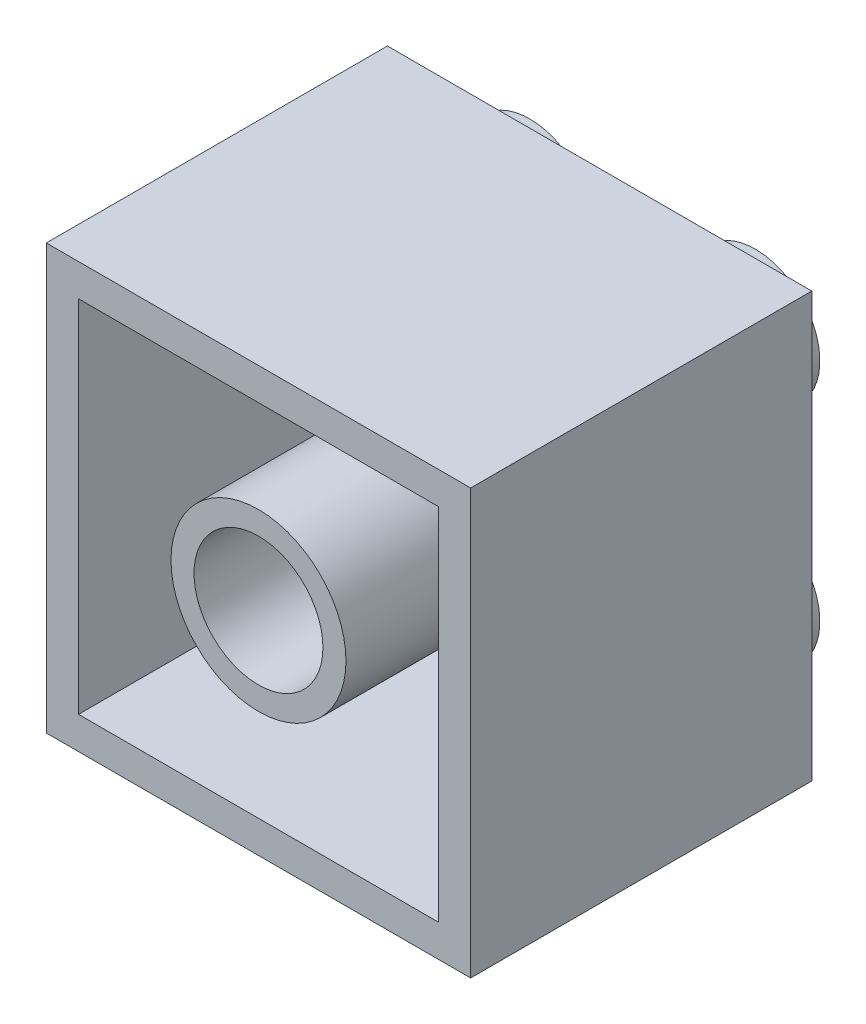
from build123d import *

# Parameters (mm, degrees)
SKETCH2_W           = 15.8
SKETCH2_H           = 15.8
BOSS_EXTRUDE1_DEPTH = 12.7
CUT_EXTRUDE1_DEPTH  = 11.49999986
SKETCH5_R           = 3.256854249
BOSS_EXTRUDE3_DEPTH = 11.5
SKETCH6_R           = 2.4
CUT_EXTRUDE2_DEPTH  = 11.5
SKETCH4_R           = 2.4
BOSS_EXTRUDE4_DEPTH = 1.6
SKETCH7_R           = 1.2
CUT_EXTRUDE3_DEPTH  = 1.6
CUT_EXTRUDE4_DEPTH  = 0.4


with BuildPart() as part:
    # Sketch2 → Boss-Extrude1 (new body)
    with BuildSketch(Plane(origin=(0, 0, 0), x_dir=(0, 1, 0), z_dir=(0, 0, 1))):
        Rectangle(SKETCH2_W, SKETCH2_H)
    extrude(amount=BOSS_EXTRUDE1_DEPTH)

    # 3DSketch1 → Cut-Extrude1 (cut)
    with BuildSketch(Plane(origin=(-6.7, -6.7, 12.7), x_dir=(0.7071067811865477, 0.7071067811865474, 0), z_dir=(0, 0, 1))):
        Polygon((0, 0), (9.475230868, -9.475230868), (18.950461736, 0), (9.475230868, 9.475230868), align=None)
    extrude(amount=-CUT_EXTRUDE1_DEPTH, mode=Mode.SUBTRACT)

    # Sketch5 → Boss-Extrude3 (add)
    with BuildSketch(Plane.XY.offset(1.20000014)):
        with Locations(Location((0, 0, 0), (0, 0, 180))):
            Circle(SKETCH5_R)
    extrude(amount=BOSS_EXTRUDE3_DEPTH)

    # Sketch6 → Cut-Extrude2 (cut)
    with BuildSketch(Plane.XY.offset(12.70000014)):
        Circle(SKETCH6_R)
    extrude(amount=-CUT_EXTRUDE2_DEPTH, mode=Mode.SUBTRACT)

    # Sketch4 → Boss-Extrude4 (add)
    with BuildSketch(Plane(origin=(0, 0, 0), x_dir=(1, 0, 0), z_dir=(0, 0, -1))):
        with Locations(Location((-4.2, 4.2, 0), (0, 0, 180))):
            Circle(SKETCH4_R)
        with Locations(Location((4.2, 4.2, 0), (0, 0, 180))):
            Circle(SKETCH4_R)
        with Locations(Location((-4.2, -4.2, 0), (0, 0, 180))):
            Circle(SKETCH4_R)
        with Locations(Location((4.2, -4.2, 0), (0, 0, 180))):
            Circle(SKETCH4_R)
    extrude(amount=BOSS_EXTRUDE4_DEPTH)

    # Sketch7 → Cut-Extrude3 (cut)
    with BuildSketch(Plane.XY.offset(1.20000014)):
        with Locations((-4.3, 4.3)):
            Circle(SKETCH7_R)
        with Locations(Location((4.3, 4.3, 0), (0, 0, 180))):
            Circle(SKETCH7_R)
        with Locations((4.3, -4.3)):
            Circle(SKETCH7_R)
        with Locations(Location((-4.3, -4.3, 0), (0, 0, 180))):
            Circle(SKETCH7_R)
    extrude(amount=-CUT_EXTRUDE3_DEPTH, mode=Mode.SUBTRACT)

    # Sketch8 → Cut-Extrude4 (cut)
    with BuildSketch(Plane(origin=(-7.9, 0, 0), x_dir=(0, -1, 0), z_dir=(-1, 0, 0))):
        Polygon((0.322443159, 4.35), (0.322443159, 7.55), (-0.877556841, 7.55), (-0.877556841, 8.35), (1.122443159, 8.35), (1.122443159, 4.35), align=None)
    extrude(amount=-CUT_EXTRUDE4_DEPTH, mode=Mode.SUBTRACT)


solid = part.part
